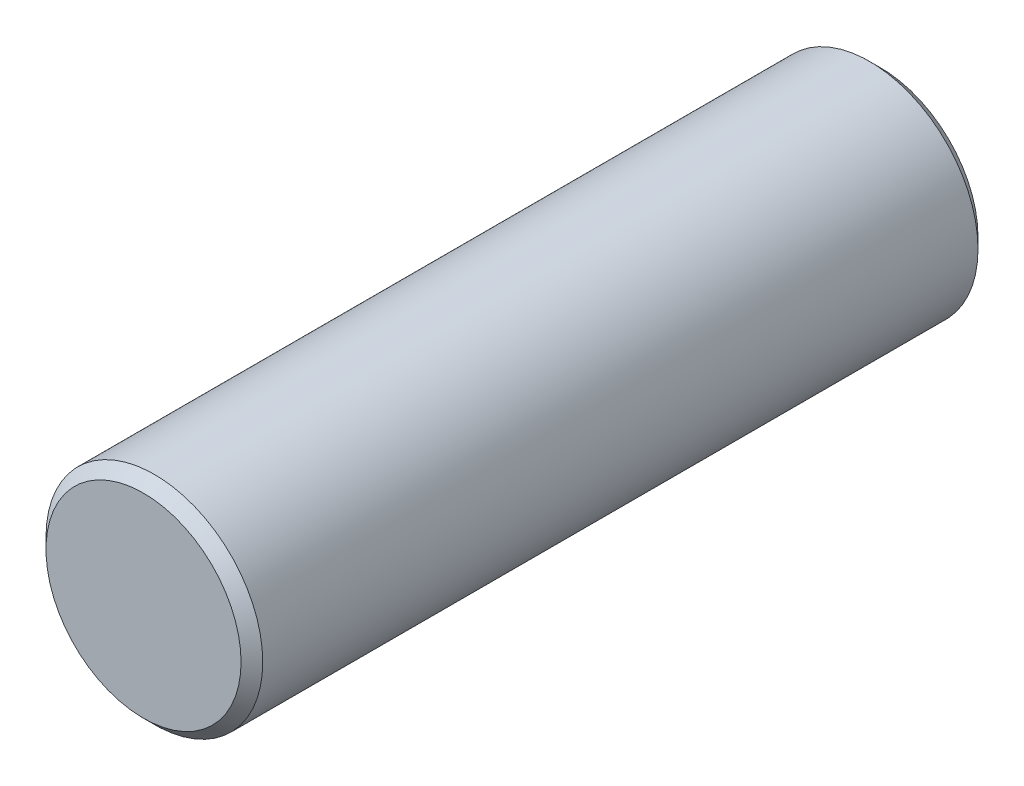
from build123d import *

# Parameters (mm, degrees)
SKETCH1_R           = 5
BOSS_EXTRUDE1_DEPTH = 17
CHAMFER1_SIZE       = 0.5
SCALE1_SCALE        = 1.5


with BuildPart() as part:
    # Sketch1 → Boss-Extrude1 (new, symmetric)
    with BuildSketch(Plane.XY):
        Circle(SKETCH1_R)
    extrude(amount=BOSS_EXTRUDE1_DEPTH, both=True)

    # Chamfer1
    chamfer1_edges = [part.edges().sort_by_distance(p)[0] for p in [
        (-5, 0, -17),
        (-5, 0, 17),
    ]]
    chamfer(chamfer1_edges, length=CHAMFER1_SIZE)


with BuildPart() as part_1:
    # Scale1: scaled about (0, 0, 0)
    add(part.part.scale(SCALE1_SCALE))


solid = part_1.part
